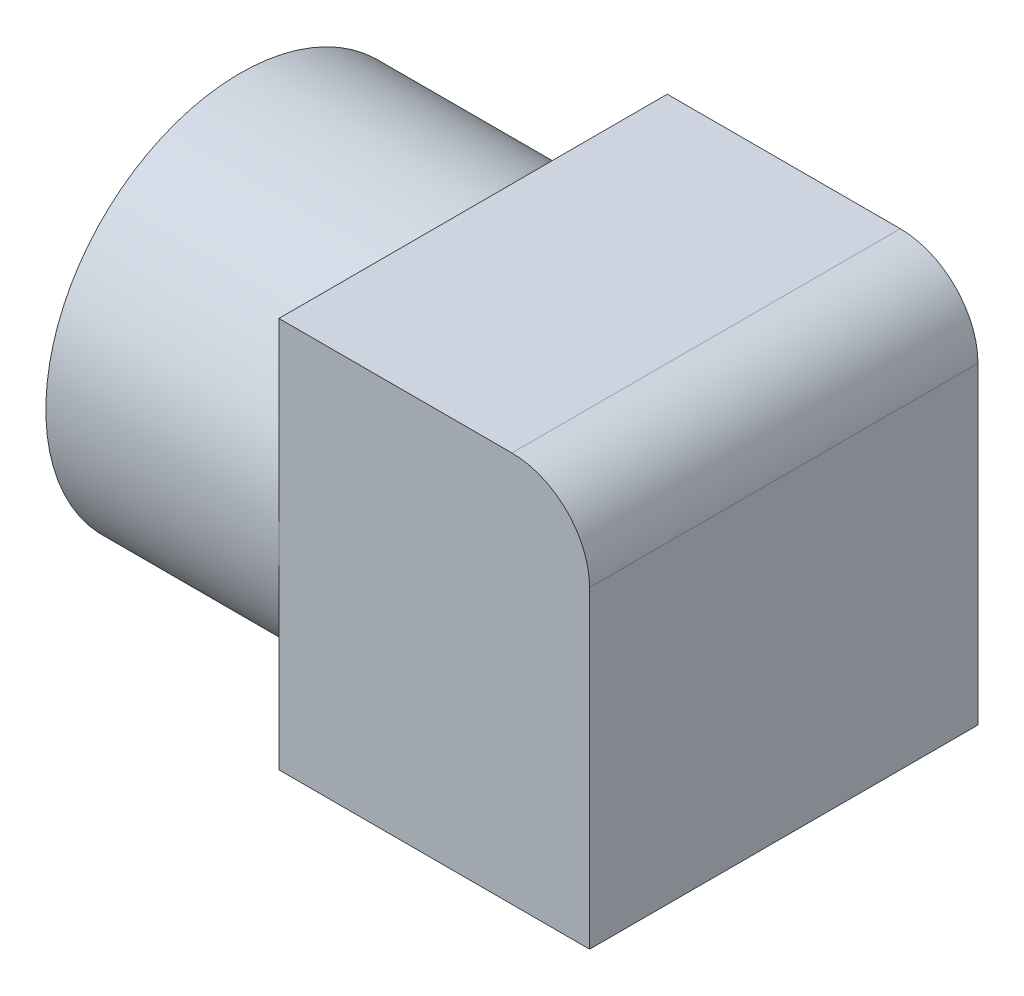
from build123d import *

# Parameters (mm, degrees)
SKETCH1_R           = 25
BOSS_EXTRUDE1_DEPTH = 30
SKETCH2_W           = 50
SKETCH2_H           = 50.327363666
BOSS_EXTRUDE2_DEPTH = 40
FILLET1_R           = 10
SKETCH3_R           = 15
CUT_EXTRUDE1_DEPTH  = 10


with BuildPart() as part:
    # Sketch1 → Boss-Extrude1 (new body)
    with BuildSketch(Plane(origin=(0, 0, 0), x_dir=(0, 0, -1), z_dir=(1, 0, 0))):
        Circle(SKETCH1_R)
    extrude(amount=BOSS_EXTRUDE1_DEPTH)

    # Sketch2 → Boss-Extrude2 (add)
    with BuildSketch(Plane(origin=(30, 0, 0), x_dir=(0, 0, -1), z_dir=(1, 0, 0))):
        Rectangle(SKETCH2_W, SKETCH2_H)
    extrude(amount=BOSS_EXTRUDE2_DEPTH)

    # Fillet1
    fillet1_edges = [part.edges().sort_by_distance(p)[0] for p in [
        (70, 25.163681833, 0),
    ]]
    fillet(fillet1_edges, radius=FILLET1_R)

    # Sketch3 → Cut-Extrude1 (cut)
    with BuildSketch(Plane.XZ.offset(25.163681833)):
        with Locations(Location((50, 0, 0), (0, 0, 270))):
            Circle(SKETCH3_R)
    extrude(amount=-CUT_EXTRUDE1_DEPTH, mode=Mode.SUBTRACT)


solid = part.part
